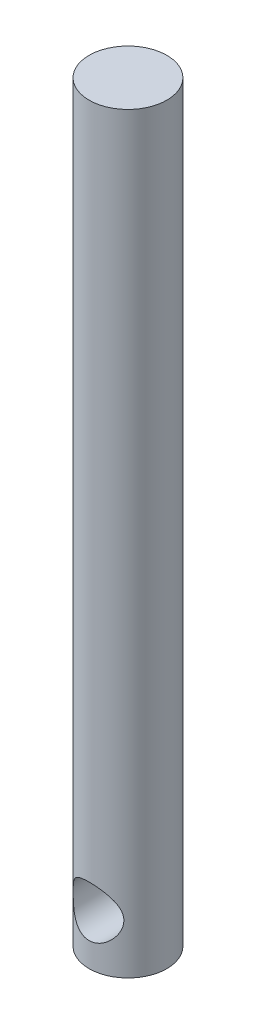
from build123d import *

# Parameters (mm, degrees)
SKETCH1_R               = 0.155
BOSS_EXTRUDE1_DEPTH     = 3
CUT_EXTRUDE1_DEPTH      = 1
CUT_EXTRUDE1_DEPTH_BACK = 1
SKETCH2_R               = 0.101131537


with BuildPart() as part:
    # Sketch1 → Boss-Extrude1 (new body)
    with BuildSketch(Plane(origin=(0, 0, 0), x_dir=(1, 0, 0), z_dir=(0, 1, 0))):
        Circle(SKETCH1_R)
    extrude(amount=BOSS_EXTRUDE1_DEPTH)

    # Sketch2 → Cut-Extrude1 (cut, two sides: drawn at the far end of the back side and taken through both)
    with BuildSketch(Plane.XY.offset(-CUT_EXTRUDE1_DEPTH_BACK)):
        with Locations((0, 0.198250965)):
            Circle(SKETCH2_R)
    extrude(amount=CUT_EXTRUDE1_DEPTH + CUT_EXTRUDE1_DEPTH_BACK, mode=Mode.SUBTRACT)


solid = part.part
